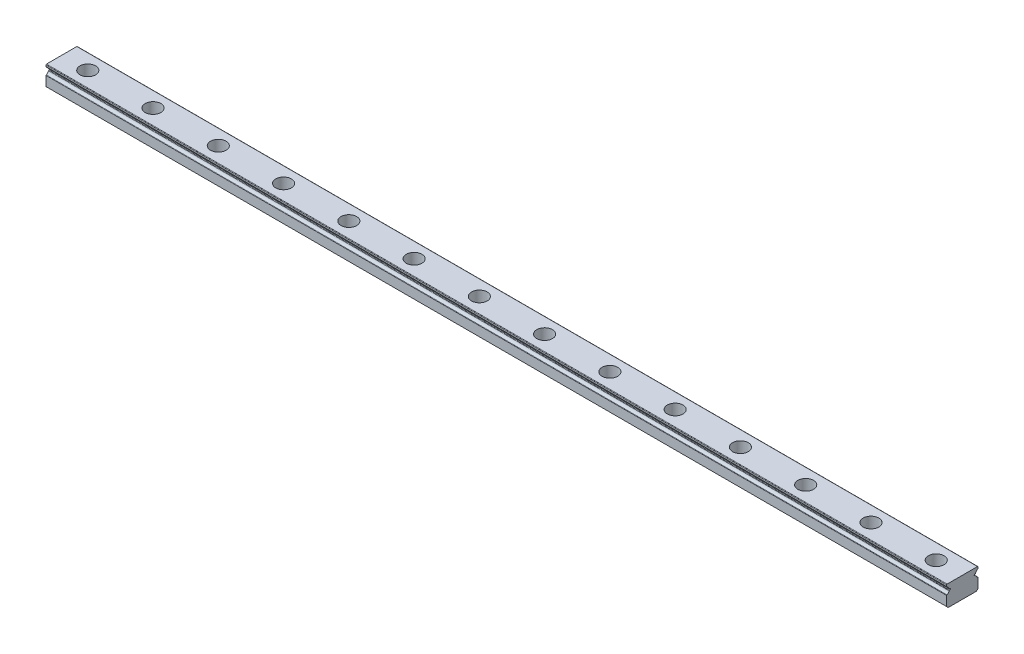
from build123d import *

# Parameters (mm, degrees)
SKETCH_1_W                   = 345
SKETCH_1_H                   = 12
EXTRUDE_1_DEPTH              = 8
CUT_EXTRUDE_1_DEPTH          = 346.07535409
CUT_EXTRUDE_2_DEPTH          = 346.07535409
CUT_EXTRUDE_3_DEPTH          = 346.07535409
CUT_EXTRUDE_4_DEPTH          = 346.07535409
CUT_EXTRUDE_5_DEPTH          = 346.07535409
CUT_EXTRUDE_6_DEPTH          = 346.07535409
HOLE_WIZARD_M3_1_D           = 3.5
HOLE_WIZARD_M3_1_CBORE_D     = 5.9999
HOLE_WIZARD_M3_1_CBORE_DEPTH = 4.5
CHAMFER_1_SIZE               = 0.6
FILLET_1_R                   = 0.2


with BuildPart() as part:
    # 草图1 → 凸台-拉伸1 (new body)
    with BuildSketch(Plane(origin=(0, 4, 0), x_dir=(1, 0, 0), z_dir=(0, 1, 0))):
        Rectangle(SKETCH_1_W, SKETCH_1_H)
    extrude(amount=-EXTRUDE_1_DEPTH)

    # 草图2 → 切除-拉伸1 (cut, through all)
    with BuildSketch(Plane(origin=(172.5, 0, 0), x_dir=(0, 0, -1), z_dir=(1, 0, 0))):
        with BuildLine():
            Line((6, 1.51), (6, 2.01))
            Line((6, 2.01), (4.8, 2.01))
            ThreePointArc((4.8, 2.01), (4.55, 1.76), (4.8, 1.51))
            Line((4.8, 1.51), (6, 1.51))
        make_face()
    extrude(amount=-CUT_EXTRUDE_1_DEPTH, mode=Mode.SUBTRACT)

    # 草图3 → 切除-拉伸2 (cut, through all)
    with BuildSketch(Plane(origin=(172.5, 0, 0), x_dir=(0, 0, -1), z_dir=(1, 0, 0))):
        with BuildLine():
            Line((6, 2.01), (6, 3.111111))
            ThreePointArc((6, 3.111111), (5.367595703, 2.693428684), (5.04, 2.01))
            Line((5.04, 2.01), (6, 2.01))
        make_face()
    extrude(amount=-CUT_EXTRUDE_2_DEPTH, mode=Mode.SUBTRACT)

    # 草图4 → 切除-拉伸3 (cut, through all)
    with BuildSketch(Plane(origin=(172.5, 0, 0), x_dir=(0, 0, -1), z_dir=(1, 0, 0))):
        with BuildLine():
            Line((6, 1.51), (5.04, 1.51))
            ThreePointArc((5.04, 1.51), (5.367595703, 0.826571316), (6, 0.408889))
            Line((6, 0.408889), (6, 1.51))
        make_face()
    extrude(amount=-CUT_EXTRUDE_3_DEPTH, mode=Mode.SUBTRACT)

    # 草图5 → 切除-拉伸4 (cut, through all)
    with BuildSketch(Plane(origin=(172.5, 0, 0), x_dir=(0, 0, -1), z_dir=(1, 0, 0))):
        with BuildLine():
            Line((-6, 2.01), (-6, 1.51))
            Line((-6, 1.51), (-4.8, 1.51))
            ThreePointArc((-4.8, 1.51), (-4.55, 1.76), (-4.8, 2.01))
            Line((-4.8, 2.01), (-6, 2.01))
        make_face()
    extrude(amount=-CUT_EXTRUDE_4_DEPTH, mode=Mode.SUBTRACT)

    # 草图6 → 切除-拉伸5 (cut, through all)
    with BuildSketch(Plane(origin=(172.5, 0, 0), x_dir=(0, 0, -1), z_dir=(1, 0, 0))):
        with BuildLine():
            Line((-6, 1.51), (-6, 0.408889))
            ThreePointArc((-6, 0.408889), (-5.367595703, 0.826571316), (-5.04, 1.51))
            Line((-5.04, 1.51), (-6, 1.51))
        make_face()
    extrude(amount=-CUT_EXTRUDE_5_DEPTH, mode=Mode.SUBTRACT)

    # 草图7 → 切除-拉伸6 (cut, through all)
    with BuildSketch(Plane(origin=(172.5, 0, 0), x_dir=(0, 0, -1), z_dir=(1, 0, 0))):
        with BuildLine():
            Line((-6, 2.01), (-5.04, 2.01))
            ThreePointArc((-5.04, 2.01), (-5.367595703, 2.693428684), (-6, 3.111111))
            Line((-6, 3.111111), (-6, 2.01))
        make_face()
    extrude(amount=-CUT_EXTRUDE_6_DEPTH, mode=Mode.SUBTRACT)

    # M3 六角头机械螺钉的柱形沉头孔1 (through all)
    with Locations(Plane(origin=(0, 4, 0), x_dir=(1, 0, 0), z_dir=(0, 1, 0))):
        with Locations((-162.5, 0), (-137.5, 0), (-112.5, 0), (-87.5, 0), (-62.5, 0), (-37.5, 0), (-12.5, 0), (12.5, 0), (37.5, 0), (62.5, 0), (87.5, 0), (112.5, 0), (137.5, 0), (162.5, 0)):
            CounterBoreHole(HOLE_WIZARD_M3_1_D / 2, HOLE_WIZARD_M3_1_CBORE_D / 2, HOLE_WIZARD_M3_1_CBORE_DEPTH)

    # 倒角1
    chamfer_1_edges = [part.edges().sort_by_distance(p)[0] for p in [
        (0, -4, -6),
        (0, -4, 6),
    ]]
    chamfer(chamfer_1_edges, length=CHAMFER_1_SIZE)

    # 圆角1
    fillet_1_edges = [part.edges().sort_by_distance(p)[0] for p in [
        (0, 2.01, -5.04),
        (0, 3.111111, -6),
        (0, 0.408889, -6),
        (0, 1.51, -5.04),
        (0, 4, -6),
        (0, 4, 6),
        (0, 1.51, 5.04),
        (0, 0.408889, 6),
        (0, 3.111111, 6),
        (0, 2.01, 5.04),
    ]]
    fillet(fillet_1_edges, radius=FILLET_1_R)


solid = part.part
